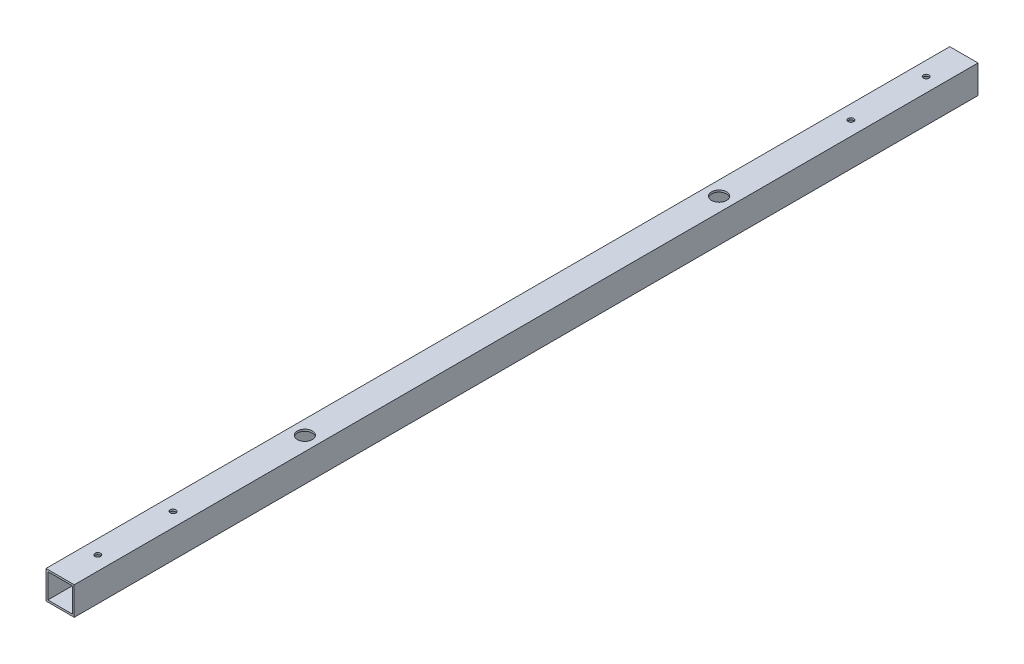
from build123d import *

# Parameters (mm, degrees)
SKETCH_1_W          = 15
SKETCH_1_H          = 15
SKETCH_1_W_2        = 13
SKETCH_1_H_2        = 13
EXTRUDE_1_DEPTH     = 460
SKETCH_2_R          = 1.5
CUT_EXTRUDE_1_DEPTH = 480
SKETCH_3_R          = 4
CUT_EXTRUDE_2_DEPTH = 2
SKETCH_4_W          = 15
SKETCH_4_H          = 15
EXTRUDE_2_DEPTH     = 10
SKETCH_5_W          = 15
SKETCH_5_H          = 15
EXTRUDE_3_DEPTH     = 10
SKETCH_6_W          = 13
SKETCH_6_H          = 13
CUT_EXTRUDE_3_DEPTH = 481.117173198
SKETCH_7_R          = 1.5
CUT_EXTRUDE_4_DEPTH = 471.299106952


with BuildPart() as part:
    # 草图1 → 凸台-拉伸1 (new body)
    with BuildSketch(Plane.XY):
        Rectangle(SKETCH_1_W, SKETCH_1_H)
        Rectangle(SKETCH_1_W_2, SKETCH_1_H_2, mode=Mode.SUBTRACT)
    extrude(amount=EXTRUDE_1_DEPTH)

    # 草图2 → 切除-拉伸1 (cut)
    with BuildSketch(Plane(origin=(0, 7.5, 0), x_dir=(1, 0, 0), z_dir=(0, 1, 0))):
        with Locations(Location((0, -120, 0), (0, 0, 270))):
            Circle(SKETCH_2_R)
        with Locations((0, -340)):
            Circle(SKETCH_2_R)
    extrude(amount=-CUT_EXTRUDE_1_DEPTH, mode=Mode.SUBTRACT)

    # 草图3 → 切除-拉伸2 (cut)
    with BuildSketch(Plane(origin=(0, 7.5, 0), x_dir=(1, 0, 0), z_dir=(0, 1, 0))):
        with Locations(Location((0, -120, 0), (0, 0, 270))):
            Circle(SKETCH_3_R)
        with Locations(Location((0, -340, 0), (0, 0, 270))):
            Circle(SKETCH_3_R)
    extrude(amount=-CUT_EXTRUDE_2_DEPTH, mode=Mode.SUBTRACT)

    # 草图4 → 凸台-拉伸2 (add)
    with BuildSketch(Plane(origin=(0, 0, 0), x_dir=(-1, 0, 0), z_dir=(0, 0, -1))):
        Rectangle(SKETCH_4_W, SKETCH_4_H)
    extrude(amount=EXTRUDE_2_DEPTH)

    # 草图5 → 凸台-拉伸3 (add)
    with BuildSketch(Plane.XY.offset(460)):
        Rectangle(SKETCH_5_W, SKETCH_5_H)
    extrude(amount=EXTRUDE_3_DEPTH)

    # 草图6 → 切除-拉伸3 (cut, through all)
    with BuildSketch(Plane.XY.offset(470)):
        Rectangle(SKETCH_6_W, SKETCH_6_H)
    extrude(amount=-CUT_EXTRUDE_3_DEPTH, mode=Mode.SUBTRACT)

    # 草图7 → 切除-拉伸4 (cut, through all)
    with BuildSketch(Plane.XZ.offset(7.5)):
        with Locations(Location((0, 10, 0), (0, 0, 270))):
            Circle(SKETCH_7_R)
        with Locations(Location((0, 50, 0), (0, 0, 270))):
            Circle(SKETCH_7_R)
        with Locations((0, 450)):
            Circle(SKETCH_7_R)
        with Locations((0, 410)):
            Circle(SKETCH_7_R)
    extrude(amount=-CUT_EXTRUDE_4_DEPTH, mode=Mode.SUBTRACT)


solid = part.part
